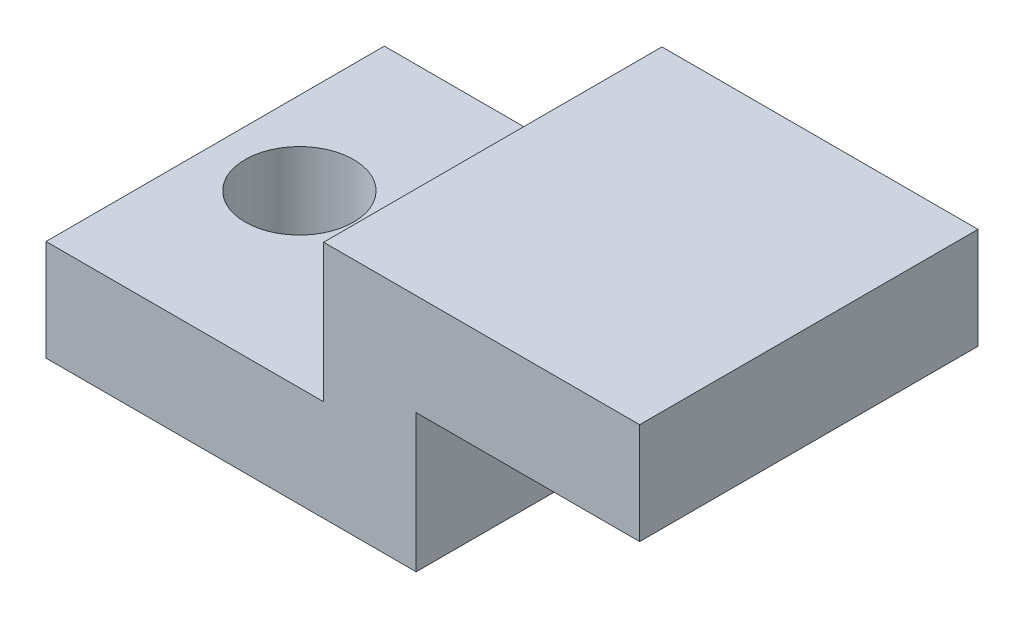
from build123d import *

# Parameters (mm, degrees)
BOSS_EXTRUDE1_DEPTH = 50
SKETCH2_R           = 8.015910741
CUT_EXTRUDE1_DEPTH  = 50


with BuildPart() as part:
    # Sketch1 → Boss-Extrude1 (new body)
    with BuildSketch(Plane.XY):
        Polygon((-32.513558384, -17.417977706), (22.191793818, -17.417977706), (22.191793818, 2.967507313), (55.22144043, 2.967507313), (55.22144043, 17.934065934), (8.515455767, 17.934065934), (8.515455767, -2.484824138), (-32.513558384, -2.484824138), align=None)
    extrude(amount=BOSS_EXTRUDE1_DEPTH)

    # Sketch2 → Cut-Extrude1 (cut)
    with BuildSketch(Plane(origin=(0, -2.484824138, 0), x_dir=(1, 0, 0), z_dir=(0, 1, 0))):
        with Locations(Location((-20.271675516, -24.792417099, 0), (0, 0, 270))):
            Circle(SKETCH2_R)
    extrude(amount=-CUT_EXTRUDE1_DEPTH, mode=Mode.SUBTRACT)


solid = part.part
